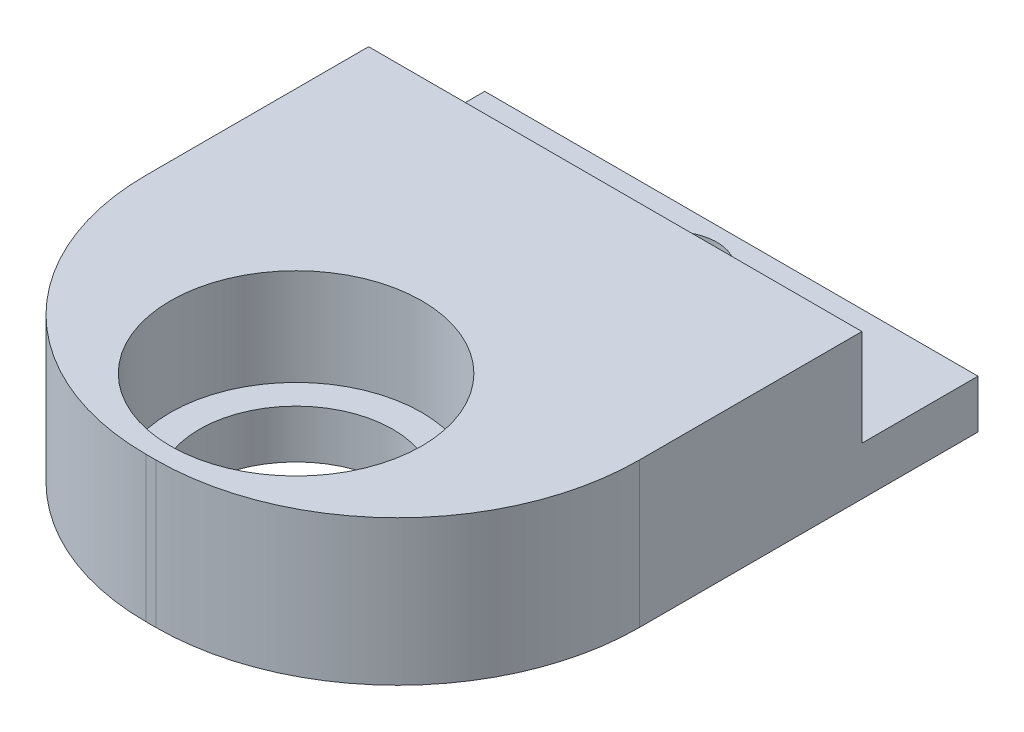
from build123d import *

# Parameters (mm, degrees)
SZKIC1_W                    = 51
SZKIC1_H                    = 60
SZKIC1_R                    = 4.5
SZKIC1_R_2                  = 10
DODANIE_WYCI_GNI_CIE1_DEPTH = 5
DODANIE_WYCI_GNI_CIE2_START = 5
SZKIC2_W                    = 51
SZKIC2_H                    = 48
SZKIC2_R                    = 13
DODANIE_WYCI_GNI_CIE2_DEPTH = 10
ZAOKR_GLENIE1_R             = 25


with BuildPart() as part:
    # Szkic1 → Dodanie-wyciągnięcie1 (new body)
    with BuildSketch(Plane(origin=(0, 0, 0), x_dir=(1, 0, 0), z_dir=(0, 1, 0))):
        Rectangle(SZKIC1_W, SZKIC1_H)
        with Locations(Location((0, 24, 0), (0, 0, 270))):
            Circle(SZKIC1_R, mode=Mode.SUBTRACT)
        with Locations(Location((0, -15, 0), (0, 0, 270))):
            Circle(SZKIC1_R_2, mode=Mode.SUBTRACT)
    extrude(amount=DODANIE_WYCI_GNI_CIE1_DEPTH)

    # Szkic2 → Dodanie-wyciągnięcie2 (add)
    with BuildSketch(Plane(origin=(0, 0, 0), x_dir=(1, 0, 0), z_dir=(0, 1, 0)).offset(DODANIE_WYCI_GNI_CIE2_START)):
        with Locations((0, -6)):
            Rectangle(SZKIC2_W, SZKIC2_H)
        with Locations(Location((0, -15, 0), (0, 0, 270))):
            Circle(SZKIC2_R, mode=Mode.SUBTRACT)
    extrude(amount=DODANIE_WYCI_GNI_CIE2_DEPTH)

    # Zaokrąglenie1
    zaokr_glenie1_edges = [part.edges().sort_by_distance(p)[0] for p in [
        (25.5, 7.5, 30),
        (-25.5, 7.5, 30),
    ]]
    fillet(zaokr_glenie1_edges, radius=ZAOKR_GLENIE1_R)


solid = part.part
